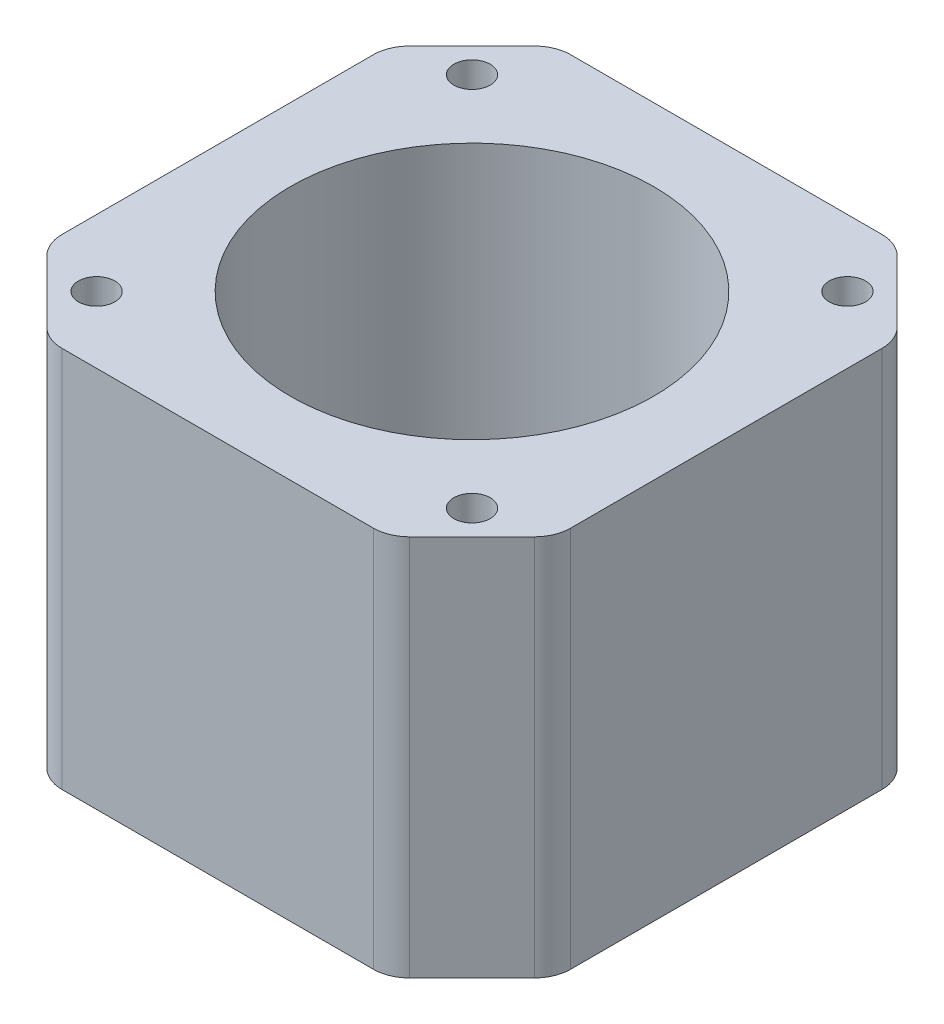
from build123d import *

# Parameters (mm, degrees)
CROQUIS1_R              = 1.5
CROQUIS1_R_2            = 15
SALIENTE_EXTRUIR1_DEPTH = 31.55


with BuildPart() as part:
    # Croquis1 → Saliente-Extruir1 (new body)
    with BuildSketch(Plane(origin=(0, 31.55, 0), x_dir=(1, 0, 0), z_dir=(0, 1, 0))):
        with BuildLine():
            Line((-12.857359313, -21), (12.857359313, -21))
            ThreePointArc((12.857359313, -21), (14.00540961, -20.771638598), (14.978679656, -20.121320344))
            Line((14.978679656, -20.121320344), (20.121320344, -14.978679656))
            ThreePointArc((20.121320344, -14.978679656), (20.771638598, -14.00540961), (21, -12.857359313))
            Line((21, -12.857359313), (21, 12.857359313))
            ThreePointArc((21, 12.857359313), (20.771638598, 14.00540961), (20.121320344, 14.978679656))
            Line((20.121320344, 14.978679656), (14.978679656, 20.121320344))
            ThreePointArc((14.978679656, 20.121320344), (14.00540961, 20.771638598), (12.857359313, 21))
            Line((12.857359313, 21), (-12.857359313, 21))
            ThreePointArc((-12.857359313, 21), (-14.00540961, 20.771638598), (-14.978679656, 20.121320344))
            Line((-14.978679656, 20.121320344), (-20.121320344, 14.978679656))
            ThreePointArc((-20.121320344, 14.978679656), (-20.771638598, 14.00540961), (-21, 12.857359313))
            Line((-21, 12.857359313), (-21, -12.857359313))
            ThreePointArc((-21, -12.857359313), (-20.771638598, -14.00540961), (-20.121320344, -14.978679656))
            Line((-20.121320344, -14.978679656), (-14.978679656, -20.121320344))
            ThreePointArc((-14.978679656, -20.121320344), (-14.00540961, -20.771638598), (-12.857359313, -21))
        make_face()
        with Locations(Location((15.5, -15.5, 0), (0, 0, 90))):
            Circle(CROQUIS1_R, mode=Mode.SUBTRACT)
        with Locations(Location((0, 0, 0), (0, 0, 90))):
            Circle(CROQUIS1_R_2, mode=Mode.SUBTRACT)
        with Locations(Location((15.5, 15.5, 0), (0, 0, 90))):
            Circle(CROQUIS1_R, mode=Mode.SUBTRACT)
        with Locations(Location((-15.5, -15.5, 0), (0, 0, 90))):
            Circle(CROQUIS1_R, mode=Mode.SUBTRACT)
        with Locations(Location((-15.5, 15.5, 0), (0, 0, 90))):
            Circle(CROQUIS1_R, mode=Mode.SUBTRACT)
    extrude(amount=-SALIENTE_EXTRUIR1_DEPTH)


solid = part.part
